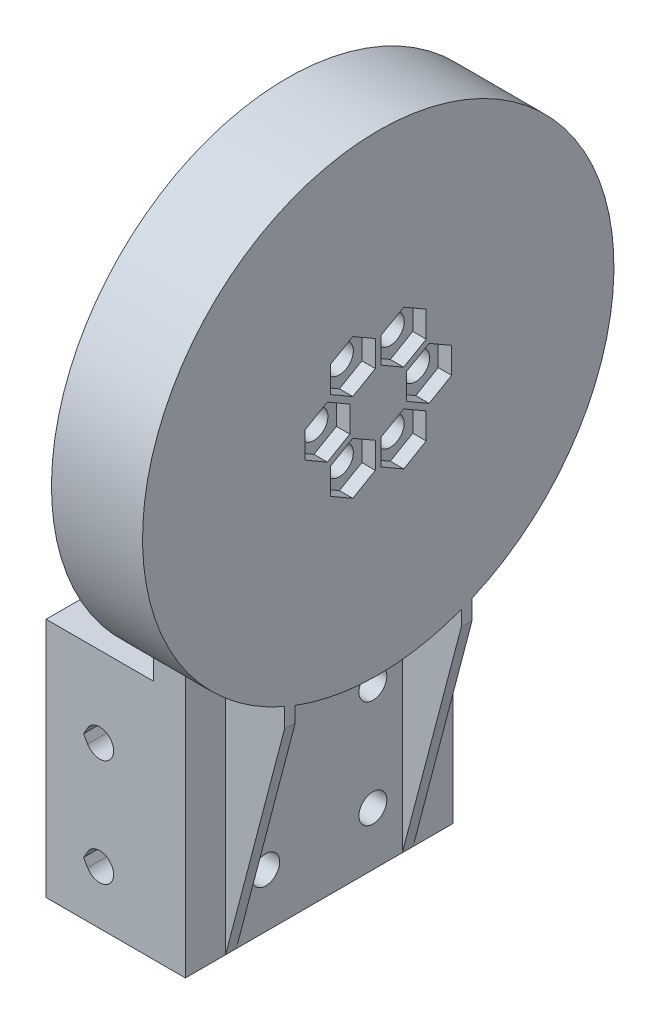
from build123d import *

# Parameters (mm, degrees)
SKETCH1_R                = 44
SKETCH1_R_2              = 2.6
BOSS_EXTRUDE1_DEPTH      = 5
BOSS_EXTRUDE2_START      = -4.5
SKETCH1_3_R              = 44
SKETCH1_3_R_2            = 22.5
BOSS_EXTRUDE2_DEPTH      = 4.5
BOSS_EXTRUDE3_START      = 7.5
SKETCH2_R                = 44
SKETCH2_R_2              = 37.7
BOSS_EXTRUDE3_DEPTH      = 7.5
BOSS_EXTRUDE4_DEPTH      = 6
SKETCH4_R                = 35.25
CUT_EXTRUDE1_DEPTH       = 1
BOSS_EXTRUDE5_DEPTH      = 20
BOSS_EXTRUDE7_DEPTH      = 1
BOSS_EXTRUDE7_DEPTH_BACK = 1
BOSS_EXTRUDE8_DEPTH      = 1
BOSS_EXTRUDE8_DEPTH_BACK = 1
SKETCH8_R                = 2.6
CUT_EXTRUDE2_DEPTH       = 101.039992003
CUT_EXTRUDE3_DEPTH       = 115.808536268
CUT_EXTRUDE4_DEPTH       = 2.5


with BuildPart() as part:
    # Sketch1 → Boss-Extrude1 (new body)
    with BuildSketch(Plane(origin=(0, 0, 0), x_dir=(0, 0, -1), z_dir=(1, 0, 0))):
        Circle(SKETCH1_R)
        with Locations((-4.75, -8.227241336)):
            Circle(SKETCH1_R_2, mode=Mode.SUBTRACT)
        with Locations((4.75, -8.227241336)):
            Circle(SKETCH1_R_2, mode=Mode.SUBTRACT)
        with Locations((9.5, 0)):
            Circle(SKETCH1_R_2, mode=Mode.SUBTRACT)
        with Locations((-9.5, 0)):
            Circle(SKETCH1_R_2, mode=Mode.SUBTRACT)
        with Locations((-4.75, 8.227241336)):
            Circle(SKETCH1_R_2, mode=Mode.SUBTRACT)
        with Locations((4.75, 8.227241336)):
            Circle(SKETCH1_R_2, mode=Mode.SUBTRACT)
    extrude(amount=BOSS_EXTRUDE1_DEPTH)

    # Sketch1<3> → Boss-Extrude2 (add)
    with BuildSketch(Plane(origin=(0, 0, 0), x_dir=(0, 0, -1), z_dir=(1, 0, 0)).offset(BOSS_EXTRUDE2_START)):
        Circle(SKETCH1_3_R)
        Circle(SKETCH1_3_R_2, mode=Mode.SUBTRACT)
    extrude(amount=BOSS_EXTRUDE2_DEPTH)

    # Sketch2 → Boss-Extrude3 (add)
    with BuildSketch(Plane.ZY.offset(4.5).offset(BOSS_EXTRUDE3_START)):
        Circle(SKETCH2_R)
        Circle(SKETCH2_R_2, mode=Mode.SUBTRACT)
    extrude(amount=-BOSS_EXTRUDE3_DEPTH)

    # Sketch3 → Boss-Extrude4 (add)
    with BuildSketch(Plane.ZY.offset(12)):
        with BuildLine():
            Line((-25, -86), (25, -86))
            Line((25, -86), (25, -36.20773398))
            ThreePointArc((25, -36.20773398), (0, -44), (-25, -36.20773398))
            Line((-25, -36.20773398), (-25, -86))
        make_face()
    extrude(amount=-BOSS_EXTRUDE4_DEPTH)

    # Sketch4 → Cut-Extrude1 (cut)
    with BuildSketch(Plane.ZY.offset(4.5)):
        Circle(SKETCH4_R)
    extrude(amount=-CUT_EXTRUDE1_DEPTH, mode=Mode.SUBTRACT)

    # Sketch5 → Boss-Extrude5 (add)
    with BuildSketch(Plane.ZY.offset(12)):
        Polygon((-25, -41), (-25, -86), (-20.1, -86), (-20.1, -46), (20.1, -46), (20.1, -86), (25, -86), (25, -41), align=None)
    extrude(amount=BOSS_EXTRUDE5_DEPTH)

    # Sketch6 → Boss-Extrude7 (add, two sides: drawn at the far end of the back side and taken through both)
    with BuildSketch(Plane.XY.offset(16.5).offset(-BOSS_EXTRUDE7_DEPTH_BACK)):
        Polygon((5, -40), (-6, -40), (-6, -86), (5, -44), align=None)
    extrude(amount=BOSS_EXTRUDE7_DEPTH + BOSS_EXTRUDE7_DEPTH_BACK)

    # Sketch7 → Boss-Extrude8 (add, two sides: drawn at the far end of the back side and taken through both)
    with BuildSketch(Plane(origin=(0, 0, -16.5), x_dir=(-1, 0, 0), z_dir=(0, 0, -1)).offset(-BOSS_EXTRUDE8_DEPTH_BACK)):
        Polygon((-5, -40), (6, -40), (6, -86), (-5, -44), align=None)
    extrude(amount=BOSS_EXTRUDE8_DEPTH + BOSS_EXTRUDE8_DEPTH_BACK)

    # Sketch8 → Cut-Extrude2 (cut, through all)
    with BuildSketch(Plane(origin=(-6, 0, 0), x_dir=(0, 0, -1), z_dir=(1, 0, 0))):
        with Locations((-10, -76)):
            Circle(SKETCH8_R)
        with Locations((10, -76)):
            Circle(SKETCH8_R)
        with Locations((-10, -56)):
            Circle(SKETCH8_R)
        with Locations((10, -56)):
            Circle(SKETCH8_R)
    extrude(amount=-CUT_EXTRUDE2_DEPTH, mode=Mode.SUBTRACT)

    # Sketch9 → Cut-Extrude3 (cut, through all)
    with BuildSketch(Plane.XY.offset(25)):
        with BuildLine():
            Line((-25, -56), (-24.253333333, -57.297107894))
            ThreePointArc((-24.253333333, -57.297107894), (-19.4, -56), (-24.253333333, -54.702892106))
            Line((-24.253333333, -54.702892106), (-25, -56))
        make_face()
        with BuildLine():
            Line((-25, -76), (-24.253333333, -77.297107894))
            ThreePointArc((-24.253333333, -77.297107894), (-19.4, -76), (-24.253333333, -74.702892106))
            Line((-24.253333333, -74.702892106), (-25, -76))
        make_face()
    extrude(amount=-CUT_EXTRUDE3_DEPTH, mode=Mode.SUBTRACT)

    # Sketch10 → Cut-Extrude4 (cut)
    with BuildSketch(Plane(origin=(5, 0, 0), x_dir=(0, 0, -1), z_dir=(1, 0, 0))):
        Polygon((9.5, -4.849742261), (13.7, -2.424871131), (13.7, 2.424871131), (9.5, 4.849742261), (5.3, 2.424871131), (5.3, -2.424871131), align=None)
        Polygon((8.95, 5.802370205), (8.95, 10.652112467), (4.75, 13.076983597), (0.55, 10.652112467), (0.55, 5.802370205), (4.75, 3.377499075), align=None)
        Polygon((0.55, -10.652112467), (4.75, -13.076983597), (8.95, -10.652112467), (8.95, -5.802370205), (4.75, -3.377499075), (0.55, -5.802370205), align=None)
        Polygon((-8.95, -5.802370205), (-8.95, -10.652112467), (-4.75, -13.076983597), (-0.55, -10.652112467), (-0.55, -5.802370205), (-4.75, -3.377499075), align=None)
        Polygon((-9.5, 4.849742261), (-13.7, 2.424871131), (-13.7, -2.424871131), (-9.5, -4.849742261), (-5.3, -2.424871131), (-5.3, 2.424871131), align=None)
        Polygon((-0.55, 10.652112467), (-4.75, 13.076983597), (-8.95, 10.652112467), (-8.95, 5.802370205), (-4.75, 3.377499075), (-0.55, 5.802370205), align=None)
    extrude(amount=-CUT_EXTRUDE4_DEPTH, mode=Mode.SUBTRACT)


solid = part.part
